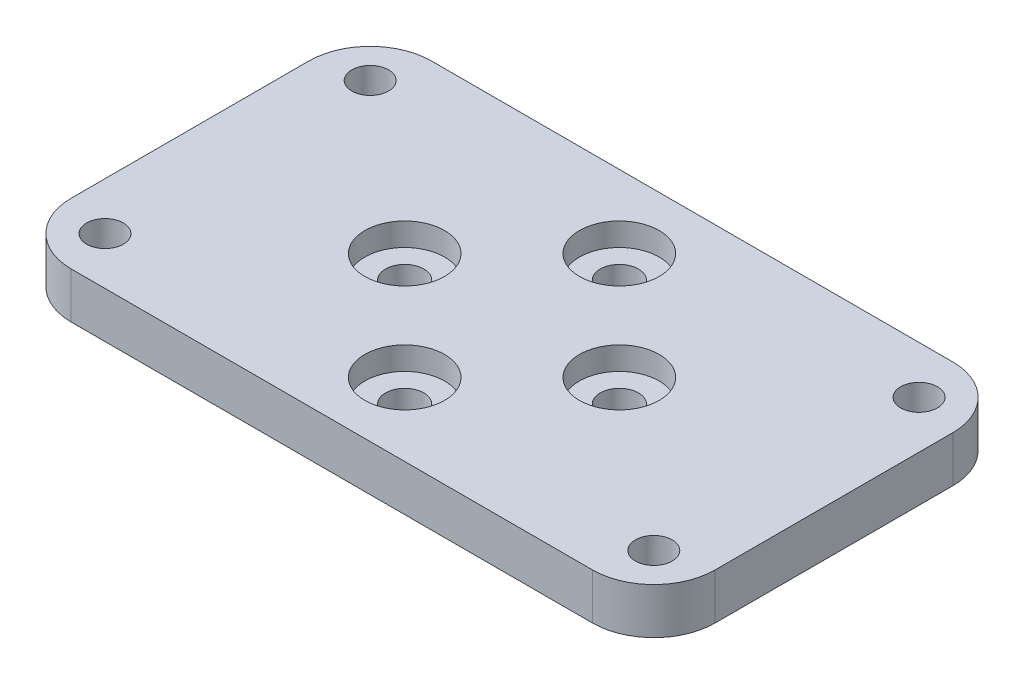
from build123d import *

# Parameters (mm, degrees)
SKETCH_1_W          = 42
SKETCH_1_H          = 23.5
SKETCH_1_R          = 1.25
SKETCH_1_R_2        = 1.2
EXTRUDE_1_DEPTH     = 3
FILLET_1_R          = 4
SKETCH_2_R          = 2.6
CUT_EXTRUDE_1_DEPTH = 1.5


with BuildPart() as part:
    # 草图1 → 凸台-拉伸1 (new body)
    with BuildSketch(Plane(origin=(0, 0, 0), x_dir=(1, 0, 0), z_dir=(0, 1, 0))):
        Rectangle(SKETCH_1_W, SKETCH_1_H)
        with Locations(Location((7, 0, 0), (0, 0, 270))):
            Circle(SKETCH_1_R, mode=Mode.SUBTRACT)
        with Locations(Location((0, -7, 0), (0, 0, 270))):
            Circle(SKETCH_1_R, mode=Mode.SUBTRACT)
        with Locations(Location((-7, 0, 0), (0, 0, 270))):
            Circle(SKETCH_1_R, mode=Mode.SUBTRACT)
        with Locations(Location((0, 7, 0), (0, 0, 270))):
            Circle(SKETCH_1_R, mode=Mode.SUBTRACT)
        with Locations(Location((-17.9, 8.65, 0), (0, 0, 270))):
            Circle(SKETCH_1_R_2, mode=Mode.SUBTRACT)
        with Locations(Location((17.9, 8.65, 0), (0, 0, 90))):
            Circle(SKETCH_1_R_2, mode=Mode.SUBTRACT)
        with Locations(Location((-17.9, -8.65, 0), (0, 0, 90))):
            Circle(SKETCH_1_R_2, mode=Mode.SUBTRACT)
        with Locations(Location((17.9, -8.65, 0), (0, 0, 270))):
            Circle(SKETCH_1_R_2, mode=Mode.SUBTRACT)
    extrude(amount=EXTRUDE_1_DEPTH)

    # 圆角1
    fillet_1_edges = [part.edges().sort_by_distance(p)[0] for p in [
        (-21, 1.5, -11.75),
        (21, 1.5, -11.75),
        (21, 1.5, 11.75),
        (-21, 1.5, 11.75),
    ]]
    fillet(fillet_1_edges, radius=FILLET_1_R)

    # 草图2 → 切除-拉伸1 (cut)
    with BuildSketch(Plane(origin=(0, 3, 0), x_dir=(1, 0, 0), z_dir=(0, 1, 0))):
        with Locations(Location((7, 0, 0), (0, 0, 270))):
            Circle(SKETCH_2_R)
        with Locations(Location((0, -7, 0), (0, 0, 270))):
            Circle(SKETCH_2_R)
        with Locations(Location((-7, 0, 0), (0, 0, 270))):
            Circle(SKETCH_2_R)
        with Locations(Location((0, 7, 0), (0, 0, 270))):
            Circle(SKETCH_2_R)
    extrude(amount=-CUT_EXTRUDE_1_DEPTH, mode=Mode.SUBTRACT)


solid = part.part
